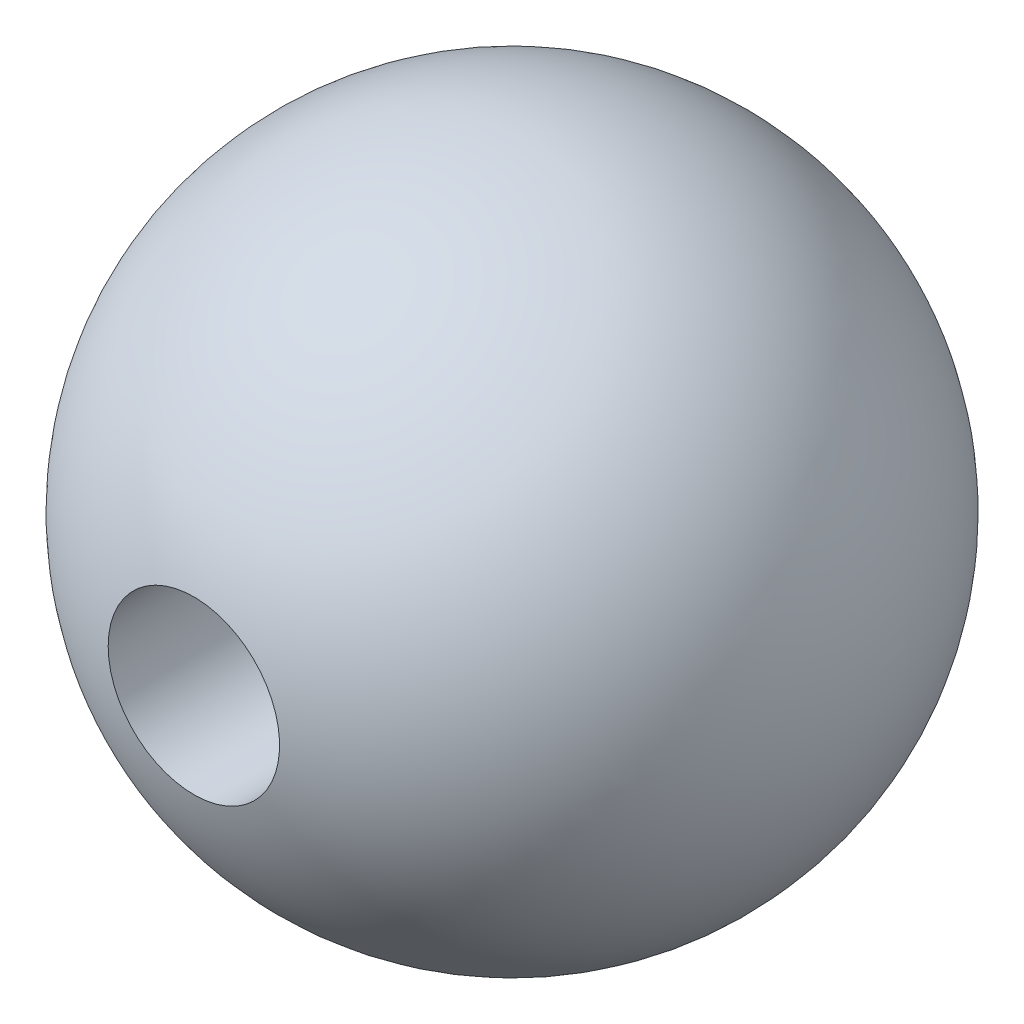
from build123d import *

# Parameters (mm, degrees)
CUT_EXTRUDE1_DEPTH      = 22.997045256
CUT_EXTRUDE1_DEPTH_BACK = 22.997045256
SKETCH2_R               = 3.302


with BuildPart() as part:
    # Sketch1 → Revolve3 (revolve)
    with BuildSketch(Plane.XY):
        with BuildLine():
            Line((0, 12.7), (0, -12.7))
            ThreePointArc((0, -12.7), (-12.7, 0), (0, 12.7))
        make_face()
    revolve(axis=Axis((0, 0, 0), (0, 1, 0)))

    # Sketch2 → Cut-Extrude1 (cut, two sides: drawn at the far end of the back side and taken through both)
    with BuildSketch(Plane.XY.offset(-CUT_EXTRUDE1_DEPTH_BACK)):
        with Locations(Location((0, 0, 0), (0, 0, 180))):
            Circle(SKETCH2_R)
    extrude(amount=CUT_EXTRUDE1_DEPTH + CUT_EXTRUDE1_DEPTH_BACK, mode=Mode.SUBTRACT)


solid = part.part
